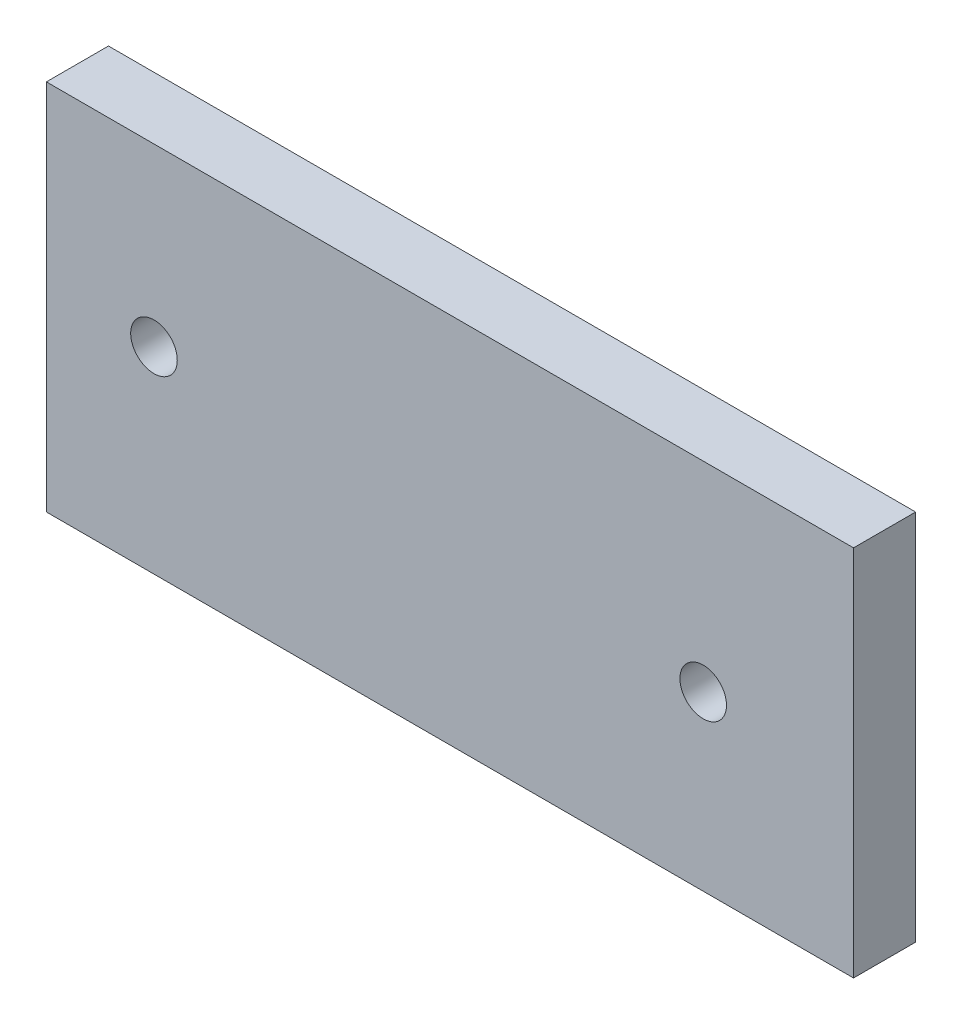
from build123d import *

# Parameters (mm, degrees)
SKETCH1_W           = 260
SKETCH1_H           = 120
BOSS_EXTRUDE1_DEPTH = 20
SKETCH2_R           = 7.5
CUT_EXTRUDE2_DEPTH  = 30


with BuildPart() as part:
    # Sketch1 → Boss-Extrude1 (new body)
    with BuildSketch(Plane.XY):
        with Locations((130, 60)):
            Rectangle(SKETCH1_W, SKETCH1_H)
    extrude(amount=BOSS_EXTRUDE1_DEPTH)

    # Sketch2 → Cut-Extrude2 (cut)
    with BuildSketch(Plane.XY.offset(20)):
        with Locations((34.659012512, 63.423333278)):
            Circle(SKETCH2_R)
        with Locations((211.577834087, 55.593539787)):
            Circle(SKETCH2_R)
    extrude(amount=-CUT_EXTRUDE2_DEPTH, mode=Mode.SUBTRACT)


solid = part.part
